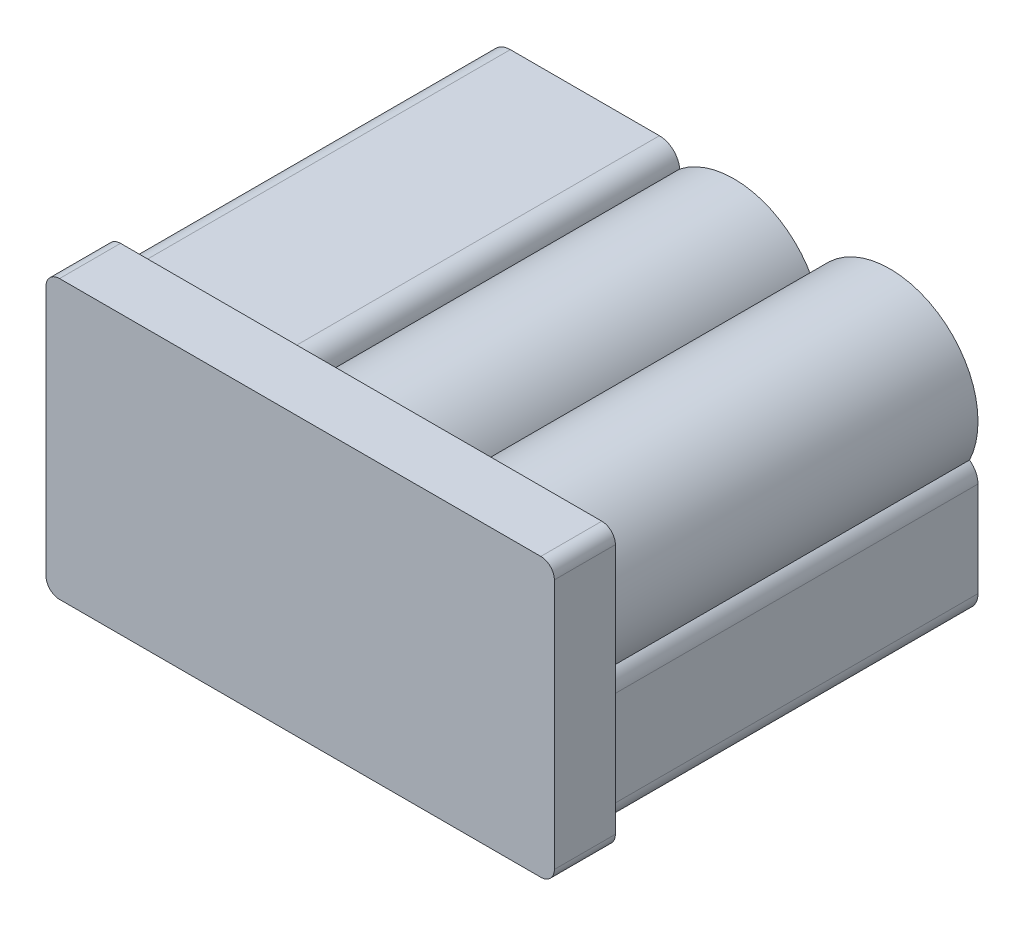
from build123d import *

# Parameters (mm, degrees)
SKETCH1_W           = 238.125
SKETCH1_H           = 130.175
BOSS_EXTRUDE1_DEPTH = 203.2
SKETCH2_W           = 238.125
SKETCH2_H           = 130.175
CUT_EXTRUDE1_DEPTH  = 174.625
FILLET1_R           = 6.35


with BuildPart() as part:
    # Sketch1 → Boss-Extrude1 (new body)
    with BuildSketch(Plane.XY):
        Rectangle(SKETCH1_W, SKETCH1_H)
    extrude(amount=BOSS_EXTRUDE1_DEPTH)

    # Sketch2 → Cut-Extrude1 (cut)
    with BuildSketch(Plane(origin=(0, 0, 0), x_dir=(-1, 0, 0), z_dir=(0, 0, -1))):
        Rectangle(SKETCH2_W, SKETCH2_H)
        with BuildLine():
            ThreePointArc((114.3, -19.05), (82.938934322, -59.116688549), (36.5125, -38.297414599))
            ThreePointArc((36.5125, -38.297414599), (8.641725006, -59.410205821), (-25.430393972, -51.56031663))
            ThreePointArc((-25.430393972, -51.56031663), (-28.464210223, -57.798844223), (-34.925, -60.325))
            Line((-34.925, -60.325), (-104.775, -60.325))
            ThreePointArc((-104.775, -60.325), (-111.510192091, -57.535192091), (-114.3, -50.8))
            Line((-114.3, -50.8), (-114.3, -6.35))
            ThreePointArc((-114.3, -6.35), (-113.249567583, -2.001744111), (-110.329957107, 1.387446384))
            ThreePointArc((-110.329957107, 1.387446384), (-91.484237132, 55.967234316), (-36.5125, 38.297414599))
            ThreePointArc((-36.5125, 38.297414599), (-8.641725006, 59.410205821), (25.430393972, 51.56031663))
            ThreePointArc((25.430393972, 51.56031663), (28.464210223, 57.798844223), (34.925, 60.325))
            Line((34.925, 60.325), (104.775, 60.325))
            ThreePointArc((104.775, 60.325), (111.510192091, 57.535192091), (114.3, 50.8))
            Line((114.3, 50.8), (114.3, 6.35))
            ThreePointArc((114.3, 6.35), (113.249567583, 2.001744111), (110.329957107, -1.387446384))
            ThreePointArc((110.329957107, -1.387446384), (113.295260302, -9.998383558), (114.3, -19.05))
        make_face(mode=Mode.SUBTRACT)
    extrude(amount=-CUT_EXTRUDE1_DEPTH, mode=Mode.SUBTRACT)

    # Fillet1
    fillet1_edges = [part.edges().sort_by_distance(p)[0] for p in [
        (119.0625, -65.0875, 188.9125),
        (-119.0625, -65.0875, 188.9125),
        (-119.0625, 65.0875, 188.9125),
        (119.0625, 65.0875, 188.9125),
    ]]
    fillet(fillet1_edges, radius=FILLET1_R)


solid = part.part
